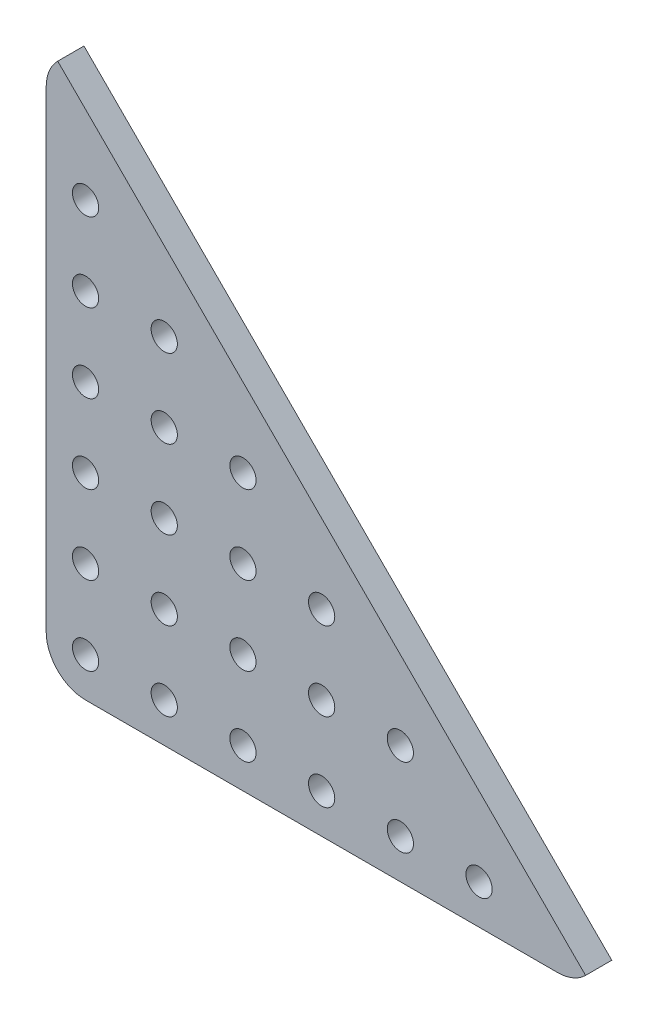
from build123d import *

# Parameters (mm, degrees)
MODEL_R                 = 1.5
SALIENTE_EXTRUIR1_DEPTH = 3


with BuildPart() as part:
    # Model → Saliente-Extruir1 (new body)
    with BuildSketch(Plane.XY):
        with BuildLine():
            Line((-105.943383637, 101.056539338), (-105.943383637, 47.056539338))
            ThreePointArc((-105.943383637, 47.056539338), (-104.625364152, 43.874558823), (-101.443383637, 42.556539338))
            Line((-101.443383637, 42.556539338), (-47.443383637, 42.556539338))
            ThreePointArc((-47.443383637, 42.556539338), (-45.721308191, 42.899081442), (-44.261403122, 43.874558823))
            Line((-44.261403122, 43.874558823), (-104.625364152, 104.238519853))
            ThreePointArc((-104.625364152, 104.238519853), (-105.600841533, 102.778614784), (-105.943383637, 101.056539338))
        make_face()
        with Locations((-101.443383637, 92.056539338)):
            Circle(MODEL_R, mode=Mode.SUBTRACT)
        with Locations((-101.443383637, 83.056539338)):
            Circle(MODEL_R, mode=Mode.SUBTRACT)
        with Locations((-92.443383637, 83.056539338)):
            Circle(MODEL_R, mode=Mode.SUBTRACT)
        with Locations((-101.443383637, 74.056539338)):
            Circle(MODEL_R, mode=Mode.SUBTRACT)
        with Locations((-92.443383637, 74.056539338)):
            Circle(MODEL_R, mode=Mode.SUBTRACT)
        with Locations((-83.443383637, 74.056539338)):
            Circle(MODEL_R, mode=Mode.SUBTRACT)
        with Locations((-101.443383637, 65.056539338)):
            Circle(MODEL_R, mode=Mode.SUBTRACT)
        with Locations((-92.443383637, 65.056539338)):
            Circle(MODEL_R, mode=Mode.SUBTRACT)
        with Locations((-83.443383637, 65.056539338)):
            Circle(MODEL_R, mode=Mode.SUBTRACT)
        with Locations((-74.443383637, 65.056539338)):
            Circle(MODEL_R, mode=Mode.SUBTRACT)
        with Locations((-101.443383637, 56.056539338)):
            Circle(MODEL_R, mode=Mode.SUBTRACT)
        with Locations((-92.443383637, 56.056539338)):
            Circle(MODEL_R, mode=Mode.SUBTRACT)
        with Locations((-83.443383637, 56.056539338)):
            Circle(MODEL_R, mode=Mode.SUBTRACT)
        with Locations((-74.443383637, 56.056539338)):
            Circle(MODEL_R, mode=Mode.SUBTRACT)
        with Locations((-65.443383637, 56.056539338)):
            Circle(MODEL_R, mode=Mode.SUBTRACT)
        with Locations((-101.443383637, 47.056539338)):
            Circle(MODEL_R, mode=Mode.SUBTRACT)
        with Locations((-92.443383637, 47.056539338)):
            Circle(MODEL_R, mode=Mode.SUBTRACT)
        with Locations((-83.443383637, 47.056539338)):
            Circle(MODEL_R, mode=Mode.SUBTRACT)
        with Locations((-74.443383637, 47.056539338)):
            Circle(MODEL_R, mode=Mode.SUBTRACT)
        with Locations((-65.443383637, 47.056539338)):
            Circle(MODEL_R, mode=Mode.SUBTRACT)
        with Locations((-56.443383637, 47.056539338)):
            Circle(MODEL_R, mode=Mode.SUBTRACT)
    extrude(amount=SALIENTE_EXTRUIR1_DEPTH)


solid = part.part
